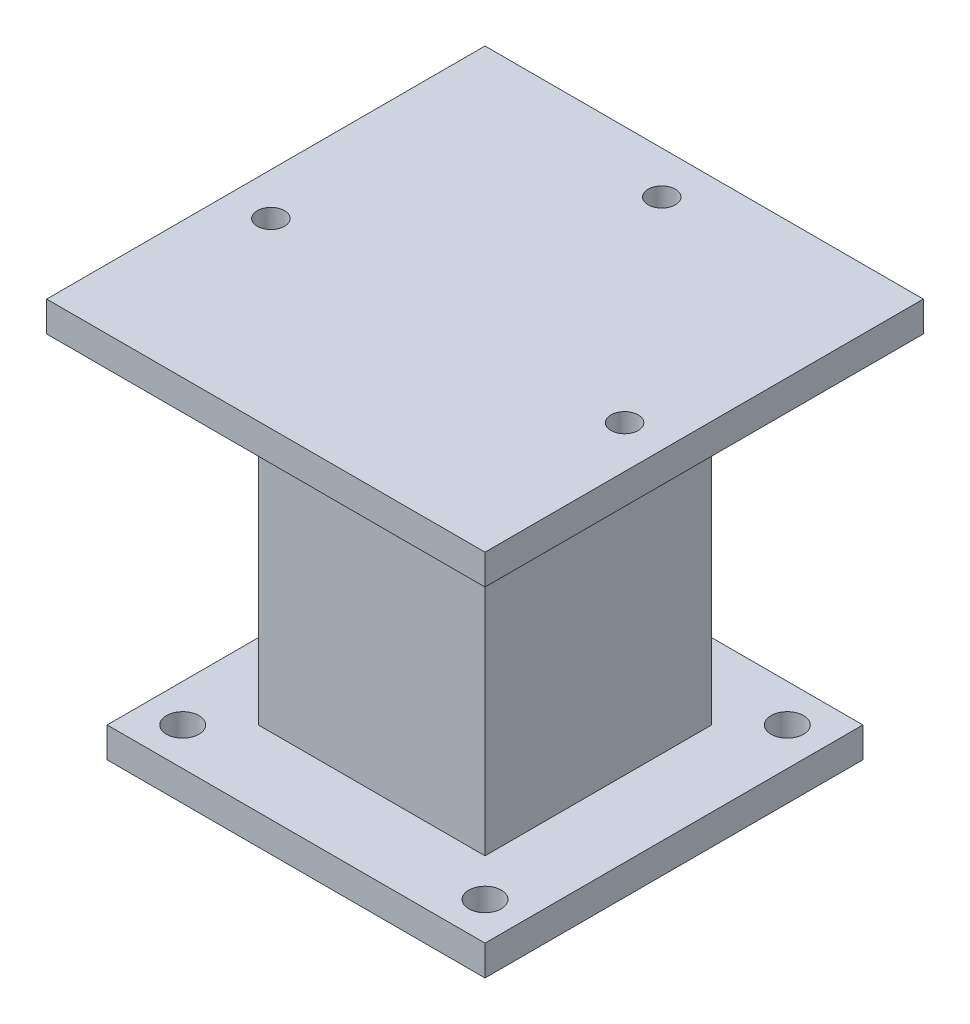
from build123d import *

# Parameters (mm, degrees)
SK_BASE_W             = 50
SK_BASE_H             = 50
EX_BASE_DEPTH         = 4
SK_DECKHOLES_R        = 2.15
CUT_DECKHOLES_DEPTH   = 4
SK_COLUMN_W           = 30
SK_COLUMN_H           = 30
EX_COLUMN_DEPTH       = 44.8
SK_TOP_W              = 58
SK_TOP_H              = 58
EX_TOP_DEPTH          = 4
SK_INSERTS_M25_R      = 1.8
CUT_INSERTS_M25_DEPTH = 4


with BuildPart() as part:
    # SK_Base → EX_Base (new body)
    with BuildSketch(Plane(origin=(0, 0, 0), x_dir=(1, 0, 0), z_dir=(0, 1, 0))):
        Rectangle(SK_BASE_W, SK_BASE_H)
    extrude(amount=EX_BASE_DEPTH)

    # SK_DeckHoles → CUT_DeckHoles (cut)
    with BuildSketch(Plane(origin=(0, 0, 0), x_dir=(1, 0, 0), z_dir=(0, 1, 0))):
        with Locations((20, -20)):
            Circle(SK_DECKHOLES_R)
        with Locations((-20, -20)):
            Circle(SK_DECKHOLES_R)
        with Locations((20, 20)):
            Circle(SK_DECKHOLES_R)
        with Locations((-20, 20)):
            Circle(SK_DECKHOLES_R)
    extrude(amount=CUT_DECKHOLES_DEPTH, mode=Mode.SUBTRACT)

    # SK_Column → EX_Column (add)
    with BuildSketch(Plane(origin=(0, 4, 0), x_dir=(1, 0, 0), z_dir=(0, 1, 0))):
        Rectangle(SK_COLUMN_W, SK_COLUMN_H)
    extrude(amount=EX_COLUMN_DEPTH)

    # SK_Top → EX_Top (add)
    with BuildSketch(Plane(origin=(0, 48.8, 0), x_dir=(1, 0, 0), z_dir=(0, 1, 0))):
        Rectangle(SK_TOP_W, SK_TOP_H)
    extrude(amount=EX_TOP_DEPTH)

    # SK_Inserts_M25 → CUT_Inserts_M25 (cut)
    with BuildSketch(Plane(origin=(0, 52.8, 0), x_dir=(1, 0, 0), z_dir=(0, 1, 0))):
        with Locations((23.4, -4.93)):
            Circle(SK_INSERTS_M25_R)
        with Locations((-23.4, -4.93)):
            Circle(SK_INSERTS_M25_R)
        with Locations((0, 23.39)):
            Circle(SK_INSERTS_M25_R)
    extrude(amount=-CUT_INSERTS_M25_DEPTH, mode=Mode.SUBTRACT)


solid = part.part
